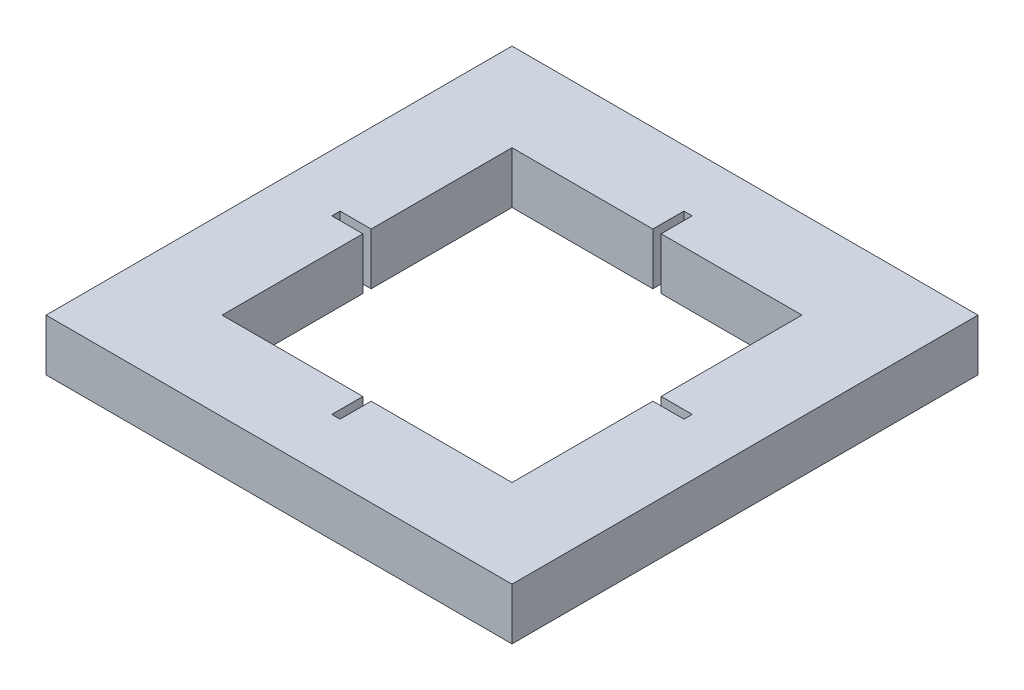
from build123d import *

# Parameters (mm, degrees)
CROQUIS1_W              = 45
CROQUIS1_H              = 45
CROQUIS1_W_2            = 28
CROQUIS1_H_2            = 28
SALIENTE_EXTRUIR1_DEPTH = 5
CROQUIS2_W              = 0.8
CROQUIS2_H              = 3
CROQUIS2_W_2            = 3
CROQUIS2_H_2            = 0.8
CORTAR_EXTRUIR1_DEPTH   = 5


with BuildPart() as part:
    # Croquis1 → Saliente-Extruir1 (new body)
    with BuildSketch(Plane(origin=(0, 0, 0), x_dir=(1, 0, 0), z_dir=(0, 1, 0))):
        with Locations((22.5, -22.5)):
            Rectangle(CROQUIS1_W, CROQUIS1_H)
        with Locations((22.5, -22.5)):
            Rectangle(CROQUIS1_W_2, CROQUIS1_H_2, mode=Mode.SUBTRACT)
    extrude(amount=SALIENTE_EXTRUIR1_DEPTH)

    # Croquis2 → Cortar-Extruir1 (cut)
    with BuildSketch(Plane.XZ):
        with Locations((22.5, 38)):
            Rectangle(CROQUIS2_W, CROQUIS2_H)
        with Locations((38, 22.5)):
            Rectangle(CROQUIS2_W_2, CROQUIS2_H_2)
        with Locations((22.5, 7)):
            Rectangle(CROQUIS2_W, CROQUIS2_H)
        with Locations((7, 22.5)):
            Rectangle(CROQUIS2_W_2, CROQUIS2_H_2)
    extrude(amount=-CORTAR_EXTRUIR1_DEPTH, mode=Mode.SUBTRACT)


solid = part.part
